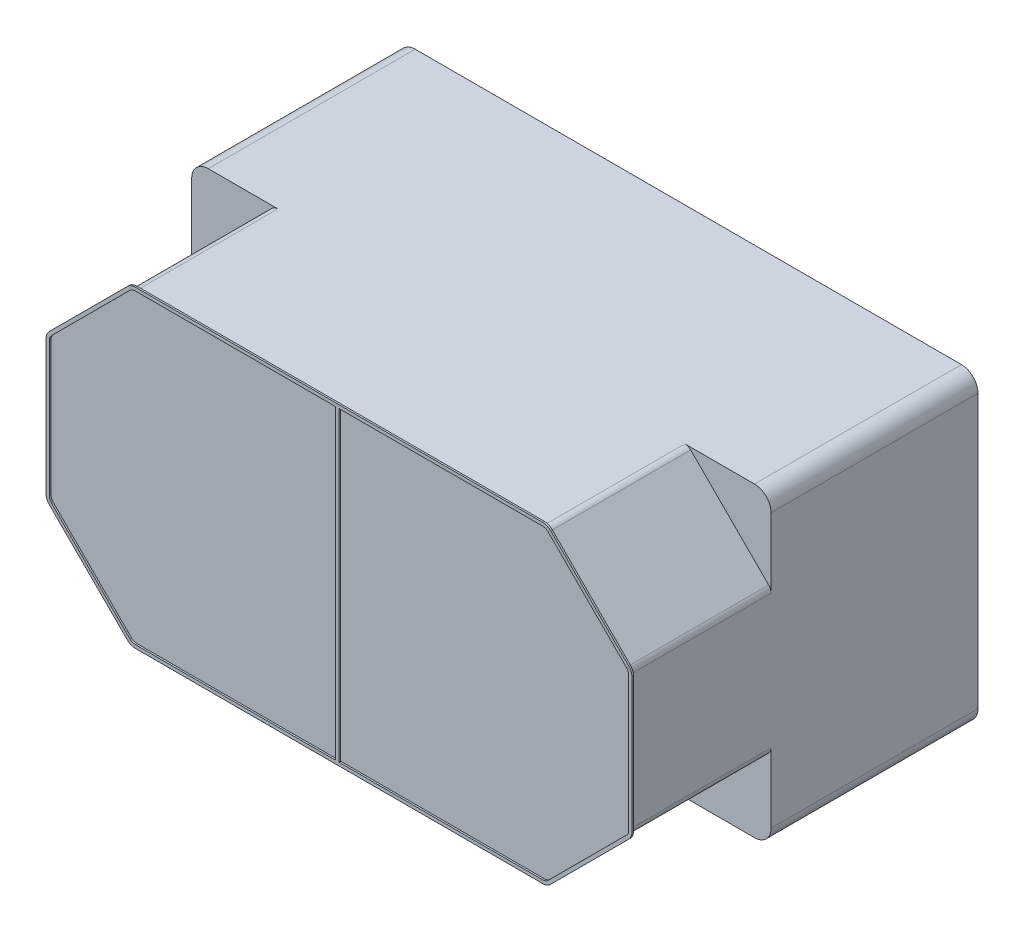
from build123d import *

# Parameters (mm, degrees)
SKETCH_1_W          = 35
SKETCH_1_H          = 18.5
EXTRUDE_1_DEPTH     = 12.5
EXTRUDE_2_DEPTH     = 8.5
FILLET_1_R          = 1
FILLET_2_R          = 0.5
SKETCH_3_R          = 1
CUT_EXTRUDE_1_DEPTH = 4
SKETCH_4_W          = 7.8
SKETCH_4_H          = 3.7
EXTRUDE_3_DEPTH     = 7.5
SKETCH_5_W          = 0.2
SKETCH_5_H          = 18.5
EXTRUDE_3_2_DEPTH   = 0.1


with BuildPart() as part:
    # 草图1 → 凸台-拉伸1 (new body)
    with BuildSketch(Plane.XY):
        with Locations((0, 100.966677277)):
            Rectangle(SKETCH_1_W, SKETCH_1_H)
    extrude(amount=EXTRUDE_1_DEPTH)

    # 草图2 → 凸台-拉伸2 (add)
    with BuildSketch(Plane.XY.offset(12.5)):
        Polygon((-12.5, 110.216677277), (-17.5, 105.216677277), (-17.5, 96.716677277), (-12.5, 91.716677277), (12.5, 91.716677277), (17.5, 96.716677277), (17.5, 105.216677277), (12.5, 110.216677277), align=None)
    extrude(amount=EXTRUDE_2_DEPTH)

    # 圆角1
    fillet_1_edges = [part.edges().sort_by_distance(p)[0] for p in [
        (-17.5, 110.216677277, 6.25),
        (17.5, 110.216677277, 6.25),
        (17.5, 91.716677277, 6.25),
        (-17.5, 91.716677277, 6.25),
    ]]
    fillet(fillet_1_edges, radius=FILLET_1_R)

    # 圆角2
    fillet_2_edges = [part.edges().sort_by_distance(p)[0] for p in [
        (-17.5, 105.216677277, 16.75),
        (-17.5, 96.716677277, 16.75),
        (-12.5, 91.716677277, 16.75),
        (12.5, 91.716677277, 16.75),
        (17.5, 96.716677277, 16.75),
        (17.5, 105.216677277, 16.75),
        (12.5, 110.216677277, 16.75),
        (-12.5, 110.216677277, 16.75),
    ]]
    fillet(fillet_2_edges, radius=FILLET_2_R)

    # 草图3 → 切除-拉伸1 (cut)
    with BuildSketch(Plane(origin=(0, 0, 0), x_dir=(-1, 0, 0), z_dir=(0, 0, -1))):
        with Locations((14, 95.216677277)):
            Circle(SKETCH_3_R)
        with Locations((-14, 106.716677277)):
            Circle(SKETCH_3_R)
    extrude(amount=-CUT_EXTRUDE_1_DEPTH, mode=Mode.SUBTRACT)

    # 草图4 → Extrude 3 (add)
    with BuildSketch(Plane.XZ.offset(-91.716677277)):
        with Locations((0, 1.85)):
            Rectangle(SKETCH_4_W, SKETCH_4_H)
    extrude(amount=EXTRUDE_3_DEPTH)


with BuildPart() as body_2:
    # 草图5 → Extrude 3 2 (new body)
    # profile 1 of 2: a face of its own
    with BuildSketch(Plane.XY.offset(21)):
        with BuildLine():
            Line((12.787867966, 91.721702531), (17.494974747, 96.428809312))
            ThreePointArc((17.494974747, 96.428809312), (17.646715673, 96.655905656), (17.7, 96.923784059))
            Line((17.7, 96.923784059), (17.7, 105.009570496))
            ThreePointArc((17.7, 105.009570496), (17.646715673, 105.277448899), (17.494974747, 105.504545243))
            Line((17.494974747, 105.504545243), (12.787867966, 110.211652024))
            ThreePointArc((12.787867966, 110.211652024), (12.560771621, 110.36339295), (12.292893219, 110.416677277))
            Line((12.292893219, 110.416677277), (-12.292893219, 110.416677277))
            ThreePointArc((-12.292893219, 110.416677277), (-12.560771621, 110.36339295), (-12.787867966, 110.211652024))
            Line((-12.787867966, 110.211652024), (-17.494974747, 105.504545243))
            ThreePointArc((-17.494974747, 105.504545243), (-17.646715673, 105.277448899), (-17.7, 105.009570496))
            Line((-17.7, 105.009570496), (-17.7, 96.923784059))
            ThreePointArc((-17.7, 96.923784059), (-17.646715673, 96.655905656), (-17.494974747, 96.428809312))
            Line((-17.494974747, 96.428809312), (-12.787867966, 91.721702531))
            ThreePointArc((-12.787867966, 91.721702531), (-12.560771621, 91.569961605), (-12.292893219, 91.516677277))
            Line((-12.292893219, 91.516677277), (12.292893219, 91.516677277))
            ThreePointArc((12.292893219, 91.516677277), (12.560771621, 91.569961605), (12.787867966, 91.721702531))
        make_face()
        with BuildLine():
            Line((12.646446609, 91.863123887), (17.353553391, 96.570230668))
            ThreePointArc((17.353553391, 96.570230668), (17.461939766, 96.732442342), (17.5, 96.923784059))
            Line((17.5, 96.923784059), (17.5, 105.009570496))
            ThreePointArc((17.5, 105.009570496), (17.461939766, 105.200912212), (17.353553391, 105.363123887))
            Line((17.353553391, 105.363123887), (12.646446609, 110.070230668))
            ThreePointArc((12.646446609, 110.070230668), (12.484234935, 110.178617044), (12.292893219, 110.216677277))
            Line((12.292893219, 110.216677277), (-12.292893219, 110.216677277))
            ThreePointArc((-12.292893219, 110.216677277), (-12.484234935, 110.178617044), (-12.646446609, 110.070230668))
            Line((-12.646446609, 110.070230668), (-17.353553391, 105.363123887))
            ThreePointArc((-17.353553391, 105.363123887), (-17.461939766, 105.200912212), (-17.5, 105.009570496))
            Line((-17.5, 105.009570496), (-17.5, 96.923784059))
            ThreePointArc((-17.5, 96.923784059), (-17.461939766, 96.732442342), (-17.353553391, 96.570230668))
            Line((-17.353553391, 96.570230668), (-12.646446609, 91.863123887))
            ThreePointArc((-12.646446609, 91.863123887), (-12.484234935, 91.754737511), (-12.292893219, 91.716677277))
            Line((-12.292893219, 91.716677277), (12.292893219, 91.716677277))
            ThreePointArc((12.292893219, 91.716677277), (12.484234935, 91.754737511), (12.646446609, 91.863123887))
        make_face(mode=Mode.SUBTRACT)
    # profile 2 of 2: a face of its own
    with BuildSketch(Plane.XY.offset(21)):
        with Locations((-0.1, 100.966677277)):
            Rectangle(SKETCH_5_W, SKETCH_5_H)
    extrude(amount=EXTRUDE_3_2_DEPTH)


solid = Compound([part.part, body_2.part])
